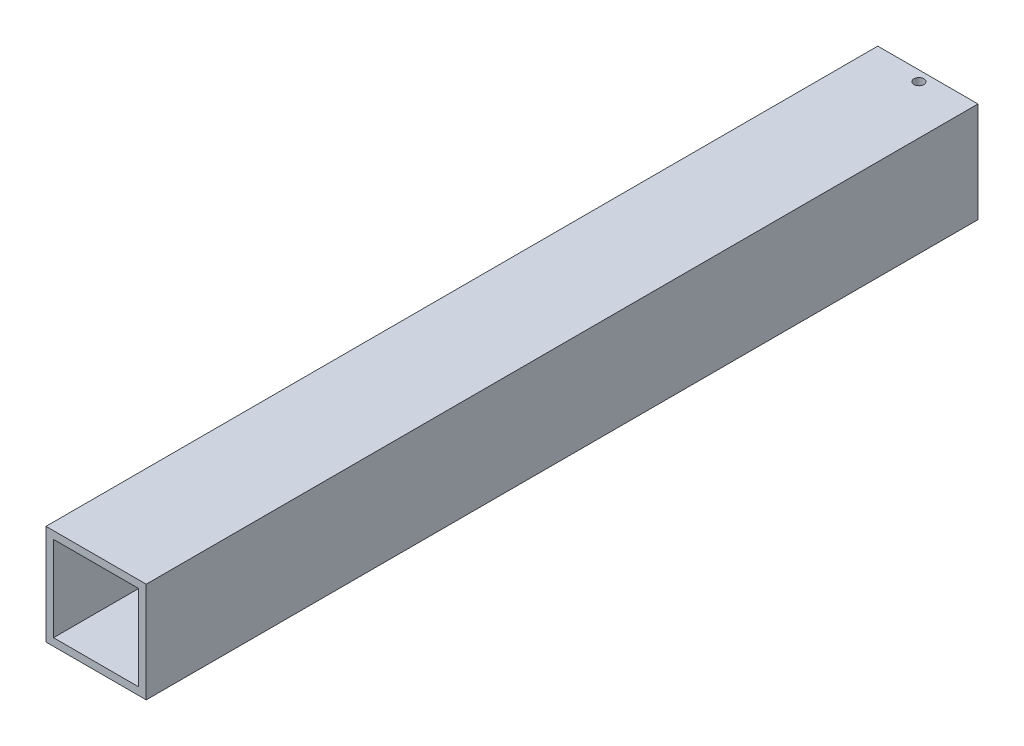
from build123d import *

# Parameters (mm, degrees)
SZKIC1_W                    = 20
SZKIC1_H                    = 20
SZKIC1_W_2                  = 17
SZKIC1_H_2                  = 17
DODANIE_WYCI_GNI_CIE1_DEPTH = 166
SZKIC3_R                    = 1
WYTNIJ_WYCI_GNI_CIE1_DEPTH  = 170.945750908


with BuildPart() as part:
    # Szkic1 → Dodanie-wyciągnięcie1 (new body)
    with BuildSketch(Plane.XY):
        with Locations((-20.422988866, 8.5)):
            Rectangle(SZKIC1_W, SZKIC1_H)
        with Locations((-20.422988866, 8.5)):
            Rectangle(SZKIC1_W_2, SZKIC1_H_2, mode=Mode.SUBTRACT)
    extrude(amount=DODANIE_WYCI_GNI_CIE1_DEPTH)

    # Szkic3 → Wytnij-wyciągnięcie1 (cut, through all)
    with BuildSketch(Plane(origin=(0, 18.5, 0), x_dir=(1, 0, 0), z_dir=(0, 1, 0))):
        with Locations(Location((-20.171616984, -2.046389983, 0), (0, 0, 180))):
            Circle(SZKIC3_R)
    extrude(amount=-WYTNIJ_WYCI_GNI_CIE1_DEPTH, mode=Mode.SUBTRACT)


solid = part.part
